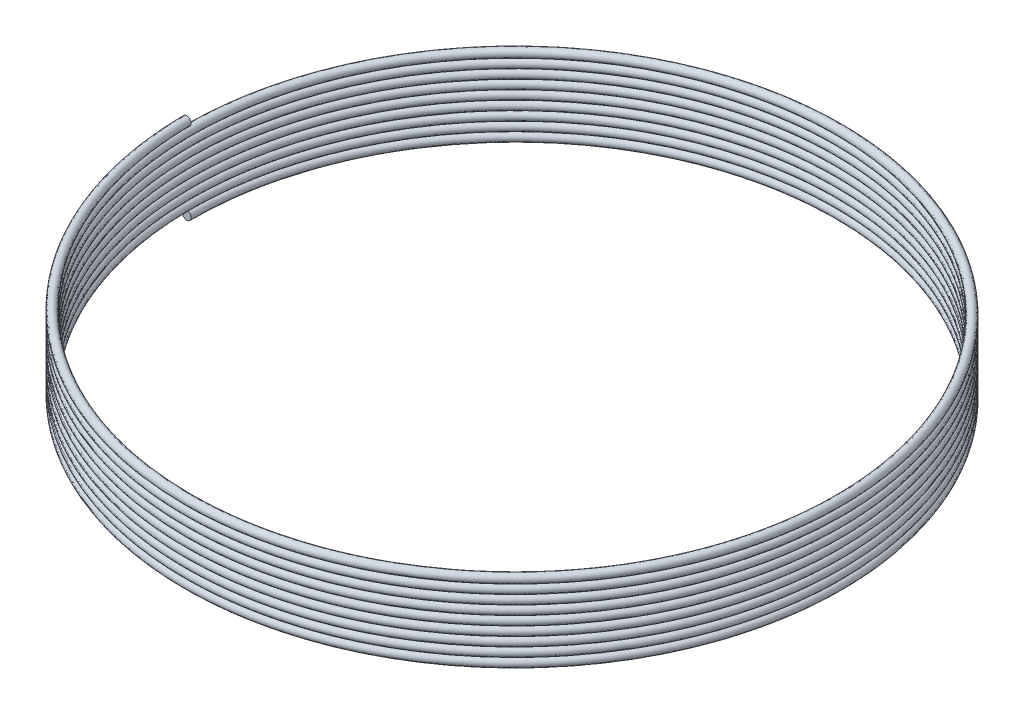
from build123d import *

# Parameters (mm, degrees)
SWEEP1_PITCH       = 0.475
SWEEP1_HEIGHT      = 4.275
SWEEP1_RADIUS      = 17
SWEEP1_START_ANGLE = -90
SWEEP1_PROFILE_R   = 0.2275


with BuildPart() as part:
    # Sweep1: sweep along a helix
    with BuildLine() as sweep1_path:
        add(Helix(SWEEP1_PITCH, SWEEP1_HEIGHT, SWEEP1_RADIUS, center=(0, 0, 0), direction=(0, 1, 0), lefthand=True, mode=Mode.PRIVATE).rotate(Axis((0, 0, 0), (0, 1, 0)), SWEEP1_START_ANGLE))
    # Sweep1 profile (on start of the path) → Sweep1 (sweep)
    with BuildSketch(Plane(origin=(-17, 0, 0), x_dir=(0, -0.9999901123473168, -0.004446932380938565), z_dir=(-5.93490929726052e-15, 0.004446932380938565, -0.9999901123473168))):
        Circle(SWEEP1_PROFILE_R)
    sweep(path=sweep1_path.line, is_frenet=True)


solid = part.part
